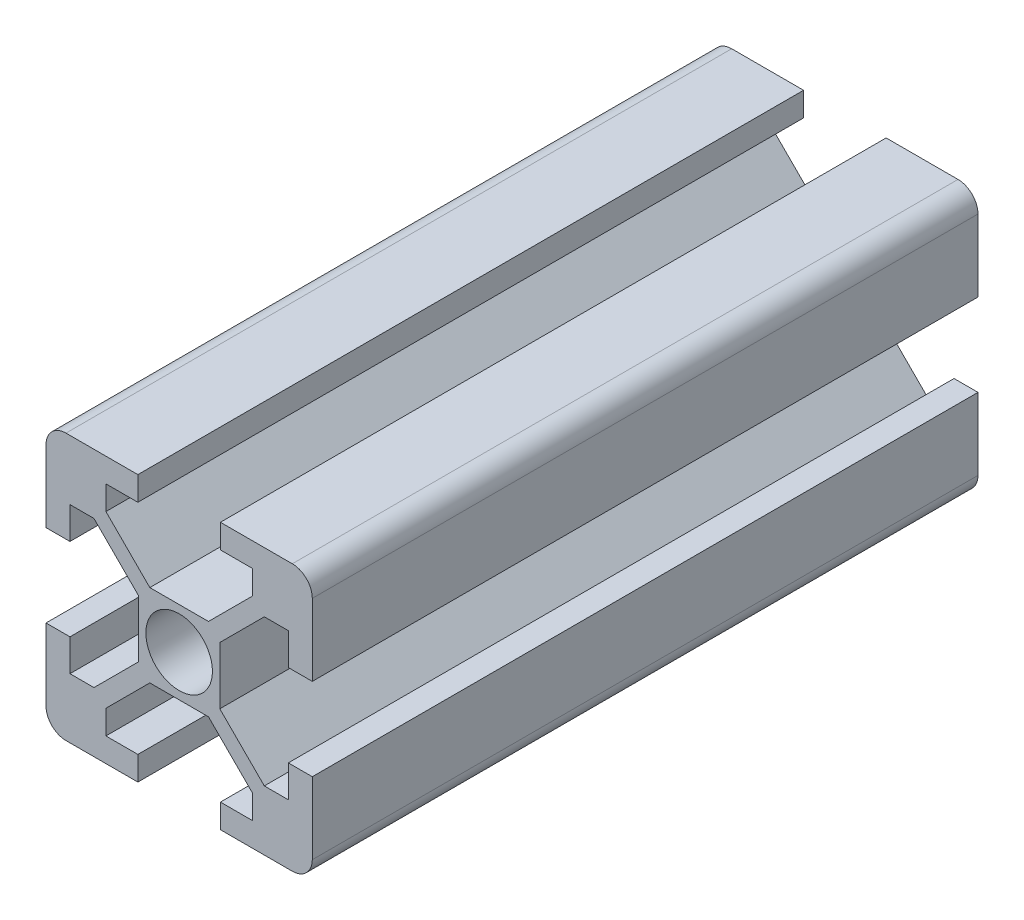
from build123d import *

# Parameters (mm, degrees)
SKETCH_1_R      = 2.5
EXTRUDE_1_DEPTH = 50


with BuildPart() as part:
    # 草图1 → 凸台-拉伸1 (new body)
    with BuildSketch(Plane.XY):
        with BuildLine():
            Line((-8.2, -3.1), (-10, -3.1))
            Line((-10, -3.1), (-10, -8.5))
            ThreePointArc((-10, -8.5), (-9.560660172, -9.560660172), (-8.5, -10))
            Line((-8.5, -10), (-3.1, -10))
            Line((-3.1, -10), (-3.1, -8.2))
            Line((-3.1, -8.2), (-5.5, -8.2))
            Line((-5.5, -8.2), (-5.5, -6.397050155))
            Line((-5.5, -6.397050155), (-2.202949845, -3.1))
            Line((-2.202949845, -3.1), (2.202949845, -3.1))
            Line((2.202949845, -3.1), (5.5, -6.397050155))
            Line((5.5, -6.397050155), (5.5, -8.2))
            Line((5.5, -8.2), (3.1, -8.2))
            Line((3.1, -8.2), (3.1, -10))
            Line((3.1, -10), (8.5, -10))
            ThreePointArc((8.5, -10), (9.560660172, -9.560660172), (10, -8.5))
            Line((10, -8.5), (10, -3.1))
            Line((10, -3.1), (8.2, -3.1))
            Line((8.2, -3.1), (8.2, -5.5))
            Line((8.2, -5.5), (6.397050155, -5.5))
            Line((6.397050155, -5.5), (3.05412702, -2.157076865))
            Line((3.05412702, -2.157076865), (3.05412702, 2.157076865))
            Line((3.05412702, 2.157076865), (6.397050155, 5.5))
            Line((6.397050155, 5.5), (8.2, 5.5))
            Line((8.2, 5.5), (8.2, 3.1))
            Line((8.2, 3.1), (10, 3.1))
            Line((10, 3.1), (10, 8.5))
            ThreePointArc((10, 8.5), (9.560660172, 9.560660172), (8.5, 10))
            Line((8.5, 10), (3.1, 10))
            Line((3.1, 10), (3.1, 8.2))
            Line((3.1, 8.2), (5.5, 8.2))
            Line((5.5, 8.2), (5.5, 6.397050155))
            Line((5.5, 6.397050155), (2.202949845, 3.1))
            Line((2.202949845, 3.1), (-2.202949845, 3.1))
            Line((-2.202949845, 3.1), (-5.5, 6.397050155))
            Line((-5.5, 6.397050155), (-5.5, 8.2))
            Line((-5.5, 8.2), (-3.1, 8.2))
            Line((-3.1, 8.2), (-3.1, 10))
            Line((-3.1, 10), (-8.5, 10))
            ThreePointArc((-8.5, 10), (-9.560660172, 9.560660172), (-10, 8.5))
            Line((-10, 8.5), (-10, 3.1))
            Line((-10, 3.1), (-8.2, 3.1))
            Line((-8.2, 3.1), (-8.2, 5.5))
            Line((-8.2, 5.5), (-6.397050155, 5.5))
            Line((-6.397050155, 5.5), (-3.05412702, 2.157076865))
            Line((-3.05412702, 2.157076865), (-3.05412702, -2.157076865))
            Line((-3.05412702, -2.157076865), (-6.397050155, -5.5))
            Line((-6.397050155, -5.5), (-8.2, -5.5))
            Line((-8.2, -5.5), (-8.2, -3.1))
        make_face()
        Circle(SKETCH_1_R, mode=Mode.SUBTRACT)
    extrude(amount=EXTRUDE_1_DEPTH)


solid = part.part
